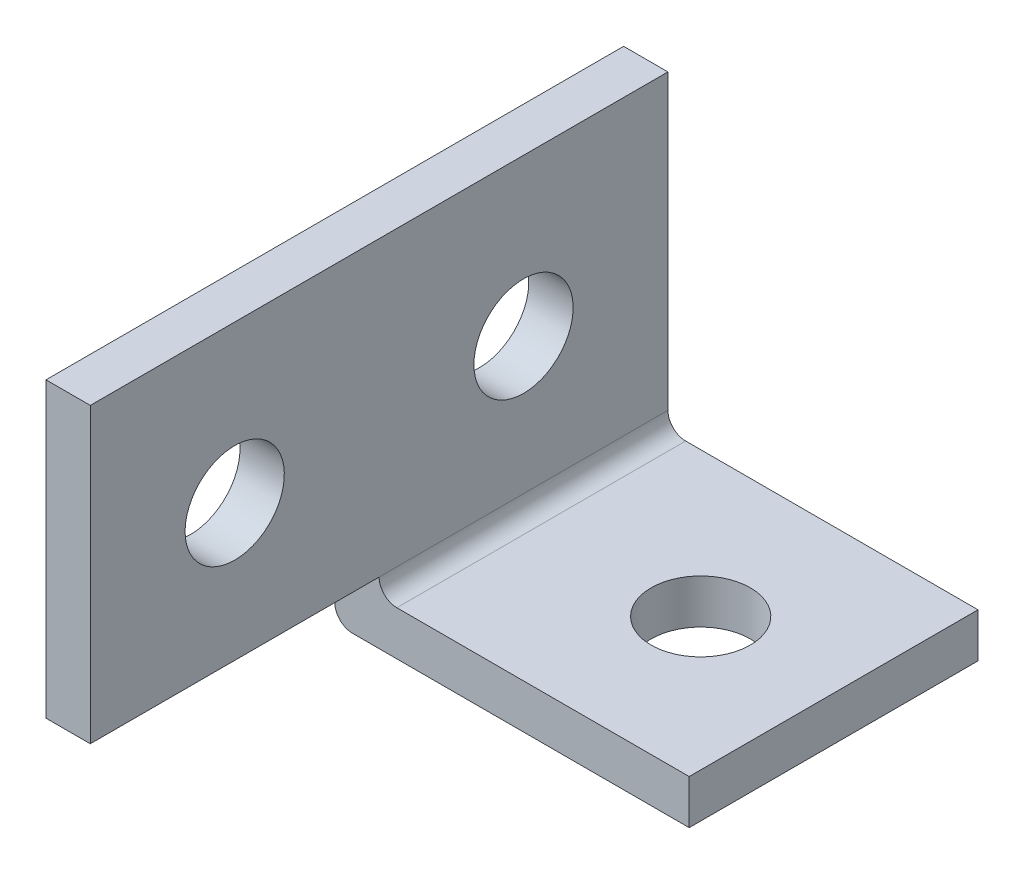
from build123d import *

# Parameters (mm, degrees)
EXTRUDE_1_DEPTH     = 41.402
SKETCH_4_R          = 7.112
CUT_EXTRUDE_1_DEPTH = 83.979969858
SKETCH_3_R          = 7.112
CUT_EXTRUDE_2_DEPTH = 83.979969858
SKETCH1_W           = 41.402
SKETCH1_H           = 42.010980282
BOSS_EXTRUDE1_DEPTH = 6.35
SKETCH3_R           = 7.112
CUT_EXTRUDE1_DEPTH  = 110.672476992


with BuildPart() as part:
    # 草图1 → 凸台-拉伸1 (new body)
    with BuildSketch(Plane.XY):
        with BuildLine():
            Line((2.54, 0), (50.8, 0))
            Line((50.8, 0), (50.8, 6.35))
            Line((50.8, 6.35), (8.89, 6.35))
            ThreePointArc((8.89, 6.35), (7.093948776, 7.093948776), (6.35, 8.89))
            Line((6.35, 8.89), (6.35, 50.900980282))
            Line((6.35, 50.900980282), (0, 50.900980282))
            Line((0, 50.900980282), (0, 2.54))
            ThreePointArc((0, 2.54), (0.743948776, 0.743948776), (2.54, 0))
        make_face()
    extrude(amount=EXTRUDE_1_DEPTH)

    # 草图4 → 切除-拉伸1 (cut, through all)
    with BuildSketch(Plane.ZY):
        with Locations((20.701, 28.448)):
            Circle(SKETCH_4_R)
    extrude(amount=-CUT_EXTRUDE_1_DEPTH, mode=Mode.SUBTRACT)

    # 草图3 → 切除-拉伸2 (cut, through all)
    with BuildSketch(Plane(origin=(0, 0, 0), x_dir=(-1, 0, 0), z_dir=(0, -1, 0))):
        with Locations(Location((-31.75, -20.701, 0), (0, 0, 90))):
            Circle(SKETCH_3_R)
    extrude(amount=-CUT_EXTRUDE_2_DEPTH, mode=Mode.SUBTRACT)

    # Sketch1 → Boss-Extrude1 (add)
    with BuildSketch(Plane.ZY):
        with Locations((62.103, 29.895490141)):
            Rectangle(SKETCH1_W, SKETCH1_H)
    extrude(amount=-BOSS_EXTRUDE1_DEPTH)

    # Sketch3 → Cut-Extrude1 (cut, through all)
    with BuildSketch(Plane.ZY):
        with Locations((20.701, 28.448)):
            Circle(SKETCH3_R)
        with Locations(Location((62.103, 28.448, 0), (0, 0, 270))):
            Circle(SKETCH3_R)
    extrude(amount=-CUT_EXTRUDE1_DEPTH, mode=Mode.SUBTRACT)


solid = part.part
